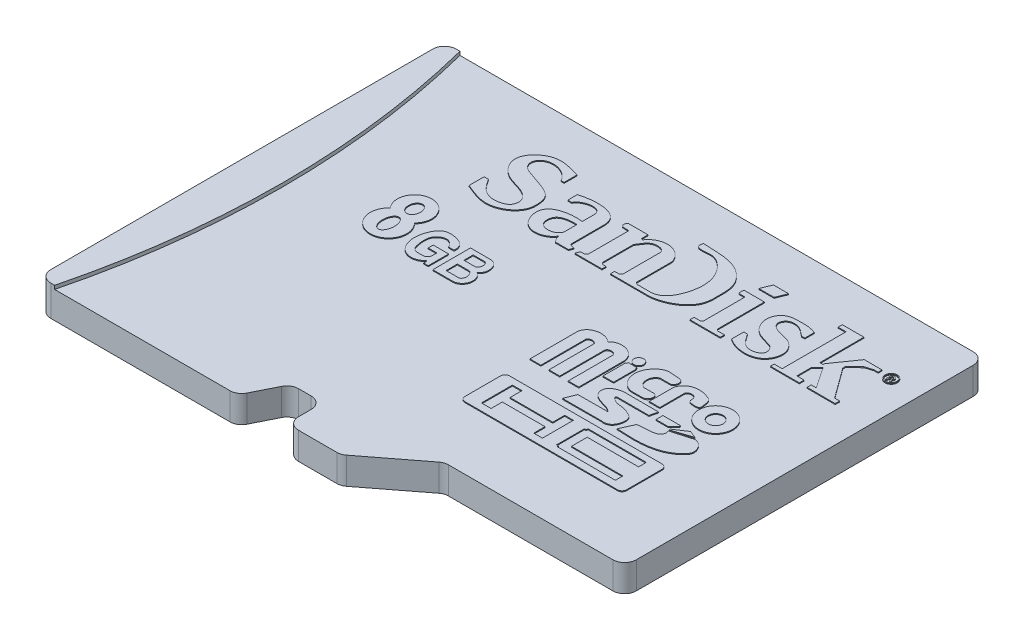
from build123d import *

# Parameters (mm, degrees)
SKETCH1_W           = 15.24
SKETCH1_H           = 11.43
BOSS_EXTRUDE1_DEPTH = 0.762
CUT_EXTRUDE1_DEPTH  = 0.762
CUT_EXTRUDE2_DEPTH  = 0.762
BOSS_EXTRUDE2_DEPTH = 0.1016
FILLET1_R           = 0.3302
SKETCH5_W           = 2.921
SKETCH5_H           = 0.889
BOSS_EXTRUDE3_DEPTH = 0.0254
SKETCH7_R           = 0.139269195
SKETCH7_R_2         = 0.478942614
SKETCH7_R_3         = 0.209449949
SKETCH7_RX          = 0.290632078
SKETCH7_RY          = 0.166319038
SKETCH7_RX_2        = 0.224370503
SKETCH7_RY_2        = 0.169046269
BOSS_EXTRUDE4_DEPTH = 0.0254
SKETCH8_R           = 0.171835043
SKETCH8_R_2         = 0.150224885
BOSS_EXTRUDE6_DEPTH = 0.0254


with BuildPart() as part:
    # Sketch1 → Boss-Extrude1 (new body)
    with BuildSketch(Plane(origin=(0, 0, 0), x_dir=(1, 0, 0), z_dir=(0, 1, 0))):
        with Locations((-7.62, 5.715)):
            Rectangle(SKETCH1_W, SKETCH1_H)
    extrude(amount=BOSS_EXTRUDE1_DEPTH)

    # Sketch2 → Cut-Extrude1 (cut)
    with BuildSketch(Plane(origin=(0, 0.762, 0), x_dir=(-1, 0, 0), z_dir=(0, 1, 0))):
        Polygon((6.731, 0), (0, 0), (0, -1.27), (5.08, -1.27), align=None)
    extrude(amount=-CUT_EXTRUDE1_DEPTH, mode=Mode.SUBTRACT)

    # Sketch3 → Cut-Extrude2 (cut)
    with BuildSketch(Plane(origin=(0, 0.762, 0), x_dir=(-1, 0, 0), z_dir=(0, 1, 0))):
        Polygon((9.652, 0), (8.255, 0), (8.255, -1.016), (9.144, -1.016), align=None)
    extrude(amount=-CUT_EXTRUDE2_DEPTH, mode=Mode.SUBTRACT)

    # Sketch4 → Boss-Extrude2 (add)
    with BuildSketch(Plane(origin=(0, 0.762, 0), x_dir=(1, 0, 0), z_dir=(0, 1, 0))):
        with BuildLine():
            Line((-15.24, 0), (-14.802465502, 0))
            ThreePointArc((-14.802465502, 0), (-14.089586207, 5.715), (-14.802465502, 11.43))
            Line((-14.802465502, 11.43), (-15.24, 11.43))
            Line((-15.24, 11.43), (-15.24, 0))
        make_face()
    extrude(amount=BOSS_EXTRUDE2_DEPTH)

    # Fillet1
    fillet1_edges = [part.edges().sort_by_distance(p)[0] for p in [
        (-15.24, 0.4318, -11.43),
        (0, 0.381, -11.43),
        (0, 0.381, -1.27),
        (-15.24, 0.4318, 0),
        (-9.652, 0.381, 0),
        (-6.731, 0.381, 0),
        (-8.255, 0.381, -1.016),
        (-8.255, 0.381, 0),
        (-9.144, 0.381, -1.016),
        (-5.08, 0.381, -1.27),
    ]]
    fillet(fillet1_edges, radius=FILLET1_R)

    # Sketch5 → Boss-Extrude3 (add)
    with BuildSketch(Plane.XZ):
        with Locations((-2.4765, -10.2235)):
            Rectangle(SKETCH5_W, SKETCH5_H)
        with Locations((-2.4765, -9.0805)):
            Rectangle(SKETCH5_W, SKETCH5_H)
        Polygon((-1.016, -8.382), (-0.508, -8.382), (-0.508, -7.493), (-1.016, -7.493), (-3.937, -7.493), (-3.937, -8.382), align=None)
        with Locations((-2.4765, -6.7945)):
            Rectangle(SKETCH5_W, SKETCH5_H)
        Polygon((-1.016, -6.096), (-0.508, -6.096), (-0.508, -5.207), (-1.016, -5.207), (-3.937, -5.207), (-3.937, -6.096), align=None)
        with Locations((-2.4765, -4.5085)):
            Rectangle(SKETCH5_W, SKETCH5_H)
        with Locations((-2.4765, -3.3655)):
            Rectangle(SKETCH5_W, SKETCH5_H)
        with Locations((-2.4765, -2.2225)):
            Rectangle(SKETCH5_W, SKETCH5_H)
    extrude(amount=BOSS_EXTRUDE3_DEPTH)

    # Sketch7 → Boss-Extrude4 (add)
    # profile 1 of 14: a face of its own
    with BuildSketch(Plane(origin=(0, 0.762, 0), x_dir=(1, 0, 0), z_dir=(0, 1, 0))):
        with Locations(Location((-4.776841085, 6.447605334, 0), (0, 0, 270))):
            Circle(SKETCH7_R)
    # profile 2 of 14: a face of its own
    with BuildSketch(Plane(origin=(0, 0.762, 0), x_dir=(1, 0, 0), z_dir=(0, 1, 0))):
        with Locations(Location((-2.277569556, 6.117436362, 0), (0, 0, 270))):
            Circle(SKETCH7_R_2)
        with Locations(Location((-2.277569556, 6.117436362, 0), (0, 0, 270))):
            Circle(SKETCH7_R_3, mode=Mode.SUBTRACT)
    # profile 3 of 14: a face of its own
    with BuildSketch(Plane(origin=(0, 0.762, 0), x_dir=(1, 0, 0), z_dir=(0, 1, 0))):
        with BuildLine():
            Line((-6.251320355, 4.277570766), (-1.948861584, 4.277570766))
            ThreePointArc((-1.948861584, 4.277570766), (-1.859059023, 4.240373327), (-1.821861584, 4.150570766))
            Line((-1.821861584, 4.150570766), (-1.821861584, 3.1466527))
            ThreePointArc((-1.821861584, 3.1466527), (-1.859059023, 3.056850139), (-1.948861584, 3.0196527))
            Line((-1.948861584, 3.0196527), (-6.251320355, 3.0196527))
            ThreePointArc((-6.251320355, 3.0196527), (-6.341122916, 3.056850139), (-6.378320355, 3.1466527))
            Line((-6.378320355, 3.1466527), (-6.378320355, 4.150570766))
            ThreePointArc((-6.378320355, 4.150570766), (-6.341122916, 4.240373327), (-6.251320355, 4.277570766))
        make_face()
        Polygon((-3.857521864, 3.260236837), (-3.857521864, 3.220393654), (-3.659080532, 3.220393654), (-2.210458816, 3.220393654), (-2.210458816, 3.432064407), (-3.659080532, 3.432064407), (-3.659080532, 3.875250046), (-2.210458816, 3.875250046), (-2.210458816, 4.09353551), (-3.659080532, 4.09353551), (-3.857521864, 4.09353551), (-3.857521864, 4.043149826), (-3.905082645, 4.043149826), (-3.905082645, 3.260236837), align=None, mode=Mode.SUBTRACT)
        Polygon((-5.987458817, 4.09353551), (-5.716255664, 4.09353551), (-5.716255664, 3.756185247), (-4.512378256, 3.756185247), (-4.512378256, 4.09353551), (-4.267633948, 4.09353551), (-4.267633948, 3.220393654), (-4.512378256, 3.220393654), (-4.512378256, 3.537899783), (-5.716255664, 3.537899783), (-5.716255664, 3.220393654), (-5.987458817, 3.220393654), align=None, mode=Mode.SUBTRACT)
    # profile 4 of 14: a face of its own
    with BuildSketch(Plane(origin=(0, 0.762, 0), x_dir=(1, 0, 0), z_dir=(0, 1, 0))):
        Polygon((-4.652156341, 6.238028849), (-4.630933406, 6.238028849), (-4.630933406, 5.590729327), (-4.933360232, 5.590729327), (-4.933360232, 6.238028849), (-4.901525829, 6.238028849), (-4.901525829, 6.275168986), (-4.652156341, 6.275168986), align=None)
    # profile 5 of 14: a face of its own
    with BuildSketch(Plane(origin=(0, 0.762, 0), x_dir=(1, 0, 0), z_dir=(0, 1, 0))):
        with BuildLine():
            Line((-6.378320355, 4.981284631), (-6.072293115, 4.981284631))
            Line((-6.072293115, 4.981284631), (-6.072293115, 6.254807833))
            add(Edge.make_bspline(
                [(-6.072293115, 6.254807833), (-6.025814039, 6.335469319), (-5.890908071, 6.339316485), (-5.844460983, 6.254807833)],
                knots=[0, 0, 0, 0, 1, 1, 1, 1], degree=3))
            Line((-5.844460983, 6.254807833), (-5.844460983, 4.981284631))
            Line((-5.844460983, 4.981284631), (-5.540684806, 4.981284631))
            Line((-5.540684806, 4.981284631), (-5.540684806, 6.254807833))
            add(Edge.make_bspline(
                [(-5.540684806, 6.254807833), (-5.501665325, 6.353707259), (-5.347044323, 6.339414302), (-5.301168975, 6.254807833)],
                knots=[0, 0, 0, 0, 1, 1, 1, 1], degree=3))
            Line((-5.301168975, 6.254807833), (-5.301168975, 4.981284631))
            Line((-5.301168975, 4.981284631), (-5.003234648, 4.981284631))
            Line((-5.003234648, 4.981284631), (-5.003234648, 6.254807833))
            add(Edge.make_bspline(
                [(-5.69376268, 6.491026115), (-5.578292108, 6.638112734), (-5.204569055, 6.651290462), (-5.00492282, 6.384604157), (-5.003234648, 6.254807833)],
                knots=[0, 0, 0, 0, 0.585628832, 1, 1, 1, 1], degree=3))
            add(Edge.make_bspline(
                [(-6.378320355, 6.254807833), (-6.394937508, 6.403298433), (-6.181945555, 6.662224119), (-5.816479439, 6.606701774), (-5.69376268, 6.491026115)],
                knots=[0, 0, 0, 0, 0.433334138, 1, 1, 1, 1], degree=3))
            Line((-6.378320355, 6.254807833), (-6.378320355, 4.981284631))
        make_face()
    # profile 6 of 14: a face of its own
    with BuildSketch(Plane(origin=(0, 0.762, 0), x_dir=(1, 0, 0), z_dir=(0, 1, 0))):
        with BuildLine():
            Line((-3.442930879, 4.5030381), (-3.276257799, 4.872496762))
            add(Edge.make_bspline(
                [(-3.276257799, 4.872496762), (-3.195110481, 4.932662785), (-2.709120649, 4.837904708), (-2.638964712, 5.080705659), (-2.665467627, 5.172797207)],
                knots=[0, 0, 0, 0, 0.752775711, 1, 1, 1, 1], degree=3))
            Line((-2.665467627, 5.172797207), (-2.092009037, 5.33783216))
            add(Edge.make_bspline(
                [(-2.092009037, 5.33783216), (-1.926617069, 5.348435845), (-1.698874786, 5.058554264), (-1.951912451, 4.763455103), (-2.460153942, 4.441377924), (-3.06272273, 4.484211554), (-3.442930879, 4.5030381)],
                knots=[0, 0, 0, 0, 0.217544023, 0.299739186, 0.470310745, 1, 1, 1, 1], degree=3))
        make_face()
    # profile 7 of 14: a face of its own
    with BuildSketch(Plane(origin=(0, 0.762, 0), x_dir=(1, 0, 0), z_dir=(0, 1, 0))):
        with BuildLine():
            Line((-3.659080532, 5.623363858), (-3.360429438, 5.623363858))
            Line((-3.360429438, 5.623363858), (-3.360429438, 6.311722044))
            add(Edge.make_bspline(
                [(-3.360429438, 6.311722044), (-3.347636385, 6.421440855), (-3.070126057, 6.43156953), (-3.125995463, 6.179769947), (-2.952128865, 6.154782514), (-2.775652786, 6.156698262), (-2.805150185, 6.378208564), (-2.819654485, 6.524921156), (-2.960942589, 6.554276085)],
                knots=[0, 0, 0, 0, 0.243554691, 0.369108319, 0.483304483, 0.637610814, 0.698918809, 1, 1, 1, 1], degree=3))
            add(Edge.make_bspline(
                [(-2.960942589, 6.554276085), (-3.20547441, 6.664771248), (-3.574720557, 6.627305367), (-3.659080532, 6.311722044)],
                knots=[0, 0, 0, 0, 1, 1, 1, 1], degree=3))
            Line((-3.659080532, 6.311722044), (-3.659080532, 5.623363858))
        make_face()
    # profile 8 of 14: a face of its own
    with BuildSketch(Plane(origin=(0, 0.762, 0), x_dir=(1, 0, 0), z_dir=(0, 1, 0))):
        with BuildLine():
            Line((-3.789933508, 5.886994865), (-4.07321967, 5.886994865))
            add(Edge.make_bspline(
                [(-4.07321967, 5.886994865), (-4.277518839, 5.964071662), (-4.265313745, 6.27578154), (-4.07321967, 6.346669088)],
                knots=[0, 0, 0, 0, 1, 1, 1, 1], degree=3))
            Line((-4.07321967, 6.346669088), (-3.789933508, 6.346669088))
            add(Edge.make_bspline(
                [(-3.789933508, 6.346669088), (-3.696468044, 6.349630045), (-3.639221758, 6.544683875), (-3.79170836, 6.609723132), (-3.943439574, 6.612172312), (-4.16602438, 6.650466802), (-4.422967428, 6.47748107), (-4.58812953, 6.17446695), (-4.499132014, 5.801670094), (-4.257188662, 5.612408196), (-4.057365325, 5.625306909), (-3.927449206, 5.624221807), (-3.786914384, 5.617884149), (-3.679471553, 5.738603932), (-3.694660661, 5.881329067), (-3.789933508, 5.886994865)],
                knots=[0, 0, 0, 0, 0.096112811, 0.118936397, 0.169797033, 0.264008921, 0.353301334, 0.48850177, 0.615129524, 0.743913282, 0.779012427, 0.830597536, 0.890279647, 0.9173965, 1, 1, 1, 1], degree=3))
        make_face()
    # profile 9 of 14: a face of its own
    with BuildSketch(Plane(origin=(0, 0.762, 0), x_dir=(1, 0, 0), z_dir=(0, 1, 0))):
        Polygon((-2.665467627, 5.212217504), (-2.176105088, 5.377160968), (-2.135135362, 5.390970134), (-2.338225648, 5.472666044), (-2.687459426, 5.243161695), (-2.677029445, 5.212217504), align=None)
    # profile 10 of 14: a face of its own
    with BuildSketch(Plane(origin=(0, 0.762, 0), x_dir=(1, 0, 0), z_dir=(0, 1, 0))):
        Polygon((-2.791284889, 5.277605324), (-2.622841988, 5.446048225), (-2.622841988, 5.472666044), (-2.791284889, 5.472666044), (-3.120813015, 5.472666044), (-3.120813015, 5.277605324), align=None)
    # profile 11 of 14: a face of its own
    with BuildSketch(Plane(origin=(0, 0.762, 0), x_dir=(1, 0, 0), z_dir=(0, 1, 0))):
        with BuildLine():
            Line((-3.270421848, 5.497775611), (-3.321593699, 5.277605324))
            Line((-3.321593699, 5.277605324), (-4.169595375, 5.277605324))
            add(Edge.make_bspline(
                [(-3.857521864, 4.477651008), (-3.6649182, 4.440969553), (-3.506100098, 4.637478531), (-3.520645806, 4.946873191), (-3.687036003, 5.040375411), (-3.890745545, 5.123789916), (-4.118976167, 5.09476977), (-4.301278004, 5.28340594), (-4.169595375, 5.277605324)],
                knots=[0, 0, 0, 0, 0.302788359, 0.449483843, 0.525021964, 0.661723021, 0.875336196, 1, 1, 1, 1], degree=3))
            Line((-3.857521864, 4.477651008), (-4.957941799, 4.473800726))
            Line((-4.957941799, 4.473800726), (-4.832807637, 4.78374842))
            Line((-4.832807637, 4.78374842), (-3.98083226, 4.789126105))
            add(Edge.make_bspline(
                [(-3.98083226, 4.789126105), (-4.007204032, 4.8036281), (-4.05204006, 4.841430131), (-4.157303597, 4.887168793), (-4.091605758, 4.876762633), (-4.216322989, 4.906102312)],
                knots=[0, 0, 0, 0, 0.136929996, 0.181845441, 0.449154446, 0.449154446, 0.449154446, 0.449154446], degree=3))
            add(Edge.make_bspline(
                [(-4.216322989, 4.906102312), (-4.333705814, 4.943445547), (-4.569057228, 4.995484764), (-4.655310287, 5.412905613), (-4.292322037, 5.515936374), (-4.163754423, 5.497775611)],
                knots=[0, 0, 0, 0, 0.366224678, 0.534720428, 1, 1, 1, 1], degree=3))
            Line((-4.163754423, 5.497775611), (-3.270421848, 5.497775611))
        make_face()
    # profile 12 of 14: a face of its own
    with BuildSketch(Plane(origin=(0, 0.762, 0), x_dir=(1, 0, 0), z_dir=(0, 1, 0))):
        with BuildLine():
            Line((-10.088130604, 5.822744395), (-10.088130604, 6.396763029))
            Line((-10.088130604, 6.396763029), (-10.524340326, 6.396763029))
            Line((-10.524340326, 6.396763029), (-10.524340326, 6.254807833))
            Line((-10.524340326, 6.254807833), (-10.278707667, 6.254807833))
            Line((-10.278707667, 6.254807833), (-10.278707667, 6.109753712))
            add(Edge.make_bspline(
                [(-10.278707667, 6.109753712), (-10.322245515, 5.981572435), (-10.419554072, 5.996573997), (-10.692784625, 5.989470413), (-10.765902538, 6.195881523), (-10.795784991, 6.588376289), (-10.552834542, 6.746726551), (-10.420627587, 6.735046541), (-10.374746649, 6.700970716)],
                knots=[0, 0, 0, 0, 0.171188729, 0.229954091, 0.387962423, 0.569830254, 0.723250193, 0.820267485, 0.820267485, 0.820267485, 0.820267485], degree=3))
            add(Edge.make_bspline(
                [(-10.374746649, 6.700970716), (-10.361083627, 6.690002358), (-10.331254784, 6.666056453), (-10.302937556, 6.640337732), (-10.28759096, 6.626399403)],
                knots=[0, 0, 0, 0, 0.458047365, 1, 1, 1, 1], degree=3))
            Line((-10.28759096, 6.626399403), (-10.258391962, 6.565093889))
            Line((-10.258391962, 6.565093889), (-10.234645397, 6.565093889))
            Line((-10.234645397, 6.565093889), (-10.106895272, 6.565093889))
            add(Edge.make_bspline(
                [(-10.106895272, 6.565093889), (-10.079625278, 6.748260422), (-10.248765594, 6.851392864)],
                knots=[0, 0, 0, 1, 1, 1], degree=2))
            add(Edge.make_bspline(
                [(-10.248765594, 6.851392864), (-10.384002118, 6.90999523), (-10.696369379, 6.978056856), (-10.890397638, 6.697974731), (-10.972414444, 6.454925721), (-10.987079209, 6.140377835), (-10.811602448, 5.830055685), (-10.488808744, 5.756631141), (-10.311153417, 5.845021196), (-10.248765594, 5.917793038)],
                knots=[0, 0, 0, 0, 0.227517437, 0.330561503, 0.433579756, 0.580561359, 0.751682886, 0.86858874, 1, 1, 1, 1], degree=3))
            Line((-10.248765594, 5.917793038), (-10.219492752, 5.917793038))
            Line((-10.219492752, 5.917793038), (-10.219492752, 5.822744395))
            Line((-10.219492752, 5.822744395), (-10.088130604, 5.822744395))
        make_face()
    # profile 13 of 14: a face of its own
    with BuildSketch(Plane(origin=(0, 0.762, 0), x_dir=(1, 0, 0), z_dir=(0, 1, 0))):
        with BuildLine():
            Line((-9.927198862, 6.851392864), (-9.927198862, 5.788396357))
            Line((-9.927198862, 5.788396357), (-9.402053177, 5.788396357))
            add(Edge.make_bspline(
                [(-9.402053177, 5.788396357), (-9.243957965, 5.777475822), (-9.017117684, 5.98687876), (-9.11583175, 6.288157941), (-9.24115103, 6.346669088)],
                knots=[0, 0, 0, 0, 0.510294589, 1, 1, 1, 1], degree=3))
            add(Edge.make_bspline(
                [(-9.24115103, 6.346669088), (-9.028875277, 6.462165203), (-9.114421292, 6.886678523), (-9.402053177, 6.851392864)],
                knots=[0, 0, 0, 0, 1, 1, 1, 1], degree=3))
            Line((-9.402053177, 6.851392864), (-9.927198862, 6.851392864))
        make_face()
        with BuildLine():
            Line((-9.719326569, 5.955756046), (-9.719326569, 6.275168986))
            Line((-9.719326569, 6.275168986), (-9.375411117, 6.275168986))
            add(Edge.make_bspline(
                [(-9.375411117, 5.955756046), (-9.319960535, 5.956015799), (-9.230142665, 6.09052178), (-9.309120454, 6.229274643), (-9.375411117, 6.275168986)],
                knots=[0, 0, 0, 0, 0.381650519, 1, 1, 1, 1], degree=3))
            Line((-9.375411117, 5.955756046), (-9.719326569, 5.955756046))
        make_face(mode=Mode.SUBTRACT)
        with BuildLine():
            Line((-9.719326569, 6.719349207), (-9.719326569, 6.458374795))
            Line((-9.719326569, 6.458374795), (-9.402053177, 6.458374795))
            add(Edge.make_bspline(
                [(-9.402053177, 6.719349207), (-9.340420425, 6.707464429), (-9.290996198, 6.591273172), (-9.340962314, 6.481268943), (-9.402053177, 6.458374795)],
                knots=[0, 0, 0, 0, 0.48427238, 1, 1, 1, 1], degree=3))
            Line((-9.402053177, 6.719349207), (-9.719326569, 6.719349207))
        make_face(mode=Mode.SUBTRACT)
    # profile 14 of 14: a face of its own
    with BuildSketch(Plane(origin=(0, 0.762, 0), x_dir=(1, 0, 0), z_dir=(0, 1, 0))):
        with BuildLine():
            ThreePointArc((-12.032854223, 6.695770031), (-11.707080782, 5.787645253), (-11.327161193, 6.67448236))
            ThreePointArc((-11.327161193, 6.67448236), (-11.655283903, 7.504728181), (-12.032854223, 6.695770031))
        make_face()
        with Locations(Location((-11.691451922, 6.305746898), (0, 0, 90))):
            Ellipse(SKETCH7_RX, SKETCH7_RY, mode=Mode.SUBTRACT)
        with Locations(Location((-11.669936942, 7.018975284), (0, 0, -90))):
            Ellipse(SKETCH7_RX_2, SKETCH7_RY_2, mode=Mode.SUBTRACT)
    extrude(amount=BOSS_EXTRUDE4_DEPTH)

    # Sketch8 → Boss-Extrude6 (add)
    # profile 1 of 9: a face of its own
    with BuildSketch(Plane(origin=(0, 0.762, 0), x_dir=(1, 0, 0), z_dir=(0, 1, 0))):
        with Locations(Location((-0.810279055, 9.597990692, 0), (0, 0, 270))):
            Circle(SKETCH8_R)
        with Locations(Location((-0.810279055, 9.597990692, 0), (0, 0, 270))):
            Circle(SKETCH8_R_2, mode=Mode.SUBTRACT)
    # profile 2 of 9: a face of its own
    with BuildSketch(Plane(origin=(0, 0.762, 0), x_dir=(1, 0, 0), z_dir=(0, 1, 0))):
        with BuildLine():
            add(Edge.make_bspline(
                [(-0.875713963, 9.675302288), (-0.819925575, 9.739366), (-0.677472879, 9.647905333), (-0.76198186, 9.579954384)],
                knots=[0, 0, 0, 0, 1, 1, 1, 1], degree=3))
            Line((-0.76198186, 9.579954384), (-0.729562786, 9.499759306))
            Line((-0.729562786, 9.499759306), (-0.765677546, 9.499759306))
            Line((-0.765677546, 9.499759306), (-0.788394894, 9.565872616))
            Line((-0.788394894, 9.565872616), (-0.841110793, 9.565872616))
            Line((-0.841110793, 9.565872616), (-0.841110793, 9.499759306))
            Line((-0.841110793, 9.499759306), (-0.875713963, 9.499759306))
            Line((-0.875713963, 9.499759306), (-0.875713963, 9.504010766))
            Line((-0.875713963, 9.504010766), (-0.875713963, 9.675302288))
        make_face()
        with BuildLine():
            ThreePointArc((-0.810279055, 9.589855645), (-0.774638526, 9.625496173), (-0.810279055, 9.661136702))
            Line((-0.810279055, 9.661136702), (-0.845919584, 9.661136702))
            Line((-0.845919584, 9.661136702), (-0.845919584, 9.589855645))
            Line((-0.845919584, 9.589855645), (-0.810279055, 9.589855645))
        make_face(mode=Mode.SUBTRACT)
    # profile 3 of 9: a face of its own
    with BuildSketch(Plane(origin=(0, 0.762, 0), x_dir=(1, 0, 0), z_dir=(0, 1, 0))):
        Polygon((-1.996850249, 8.19340523), (-1.996850249, 8.328887468), (-2.200432631, 8.328887468), (-2.200432631, 8.733358684), (-2.034742605, 8.89904871), (-1.647498691, 8.328887468), (-1.647498691, 8.309872563), (-1.77694651, 8.309872563), (-1.77694651, 8.19340523), (-0.984553165, 8.19340523), (-0.984553165, 8.319380015), (-1.12621878, 8.319380015), (-1.743493967, 9.166395086), (-1.743493967, 9.236597281), (-1.476994583, 9.499759306), (-1.262845576, 9.565872616), (-1.145810653, 9.565872616), (-1.145810653, 9.675302288), (-1.647498691, 9.675302288), (-2.109133454, 9.015757192), (-2.109133454, 8.976516622), (-2.200432631, 8.976516622), (-2.200432631, 10.218711078), (-2.809875829, 10.218711078), (-2.809875829, 10.099484416), (-2.584156126, 10.099484416), (-2.584156126, 8.296788125), (-2.809875829, 8.296788125), (-2.809875829, 8.19340523), align=None)
    # profile 4 of 9: a face of its own
    with BuildSketch(Plane(origin=(0, 0.762, 0), x_dir=(1, 0, 0), z_dir=(0, 1, 0))):
        with BuildLine():
            add(Edge.make_bspline(
                [(-3.103554732, 9.365833099), (-3.195877054, 9.434000275), (-3.347263788, 9.595333763), (-3.699451678, 9.580870387), (-3.798523567, 9.298769795), (-3.533762916, 9.114886478), (-3.195741467, 9.12032386), (-2.844351063, 8.764064303), (-3.097014561, 8.027078574), (-3.788240821, 8.138784256), (-4.022029472, 8.309872563)],
                knots=[0, 0, 0, 0, 0.10236425, 0.197563773, 0.250005214, 0.324552804, 0.434792165, 0.557846919, 0.704556384, 1, 1, 1, 1], degree=3))
            Line((-4.022029472, 8.309872563), (-4.022029472, 8.653697322))
            Line((-4.022029472, 8.653697322), (-3.918022469, 8.653697322))
            add(Edge.make_bspline(
                [(-3.918022469, 8.653697322), (-3.844827753, 8.554222214), (-3.722160942, 8.314608957), (-3.394507905, 8.286728928), (-3.158939206, 8.441434633), (-3.258055507, 8.676910708), (-3.432236441, 8.712922235), (-3.551764289, 8.761423004), (-3.902154463, 8.85519056), (-4.102687009, 9.208166252), (-3.971324575, 9.479382059)],
                knots=[0, 0, 0, 0, 0.171535744, 0.302151344, 0.380829133, 0.486857541, 0.532299497, 0.607553917, 0.653711172, 1, 1, 1, 1], degree=3))
            add(Edge.make_bspline(
                [(-3.971324575, 9.479382059), (-3.876820068, 9.680432639), (-3.508613579, 9.707106478), (-3.168705815, 9.697992423), (-3.013194044, 9.63176446)],
                knots=[0, 0, 0, 0, 0.528193232, 1, 1, 1, 1], degree=3))
            Line((-3.013194044, 9.63176446), (-3.013194044, 9.365833099))
            Line((-3.013194044, 9.365833099), (-3.103554732, 9.365833099))
        make_face()
    # profile 5 of 9: a face of its own
    with BuildSketch(Plane(origin=(0, 0.762, 0), x_dir=(1, 0, 0), z_dir=(0, 1, 0))):
        Polygon((-5.030552657, 9.52496903), (-4.8605345, 9.522220261), (-4.857724174, 9.504010766), (-4.857724174, 8.356276357), (-4.904127968, 8.309872563), (-5.080992894, 8.309872563), (-5.080992894, 8.19340523), (-4.222773891, 8.19340523), (-4.222773891, 8.309872563), (-4.420839252, 8.309872563), (-4.46322301, 8.352256321), (-4.46322301, 9.675302288), (-5.037040479, 9.675302288), (-5.044693109, 9.63176446), (-5.044693109, 9.604754691), (-5.044693109, 9.589855645), (-5.044693109, 9.565872616), (-5.040866794, 9.554804371), align=None)
    # profile 6 of 9: a face of its own
    with BuildSketch(Plane(origin=(0, 0.762, 0), x_dir=(1, 0, 0), z_dir=(0, 1, 0))):
        with BuildLine():
            add(Edge.make_bspline(
                [(-6.749088189, 10.244292243), (-6.406422027, 10.219391433), (-5.798936147, 10.268613517), (-5.268476567, 9.706795419), (-5.261519567, 9.217823225), (-5.248357388, 8.51349394), (-5.936232919, 8.192663439), (-6.273914984, 8.19340523)],
                knots=[0, 0, 0, 0, 0.290578758, 0.450128151, 0.558005535, 0.682220279, 1, 1, 1, 1], degree=3))
            Line((-6.273914984, 8.19340523), (-7.323079282, 8.19340523))
            Line((-7.323079282, 8.19340523), (-7.323079282, 8.309872563))
            Line((-7.323079282, 8.309872563), (-7.196352161, 8.309872563))
            Line((-7.196352161, 8.309872563), (-7.186745463, 8.309872563))
            Line((-7.186745463, 8.309872563), (-7.14034167, 8.356276357))
            Line((-7.14034167, 8.356276357), (-7.14034167, 9.365833099))
            add(Edge.make_bspline(
                [(-7.712210165, 9.236597281), (-7.649978047, 9.323208083), (-7.563418919, 9.521620648), (-7.27527465, 9.564927779), (-7.126966588, 9.4815588), (-7.14034167, 9.365833099)],
                knots=[0, 0, 0, 0, 0.432808199, 0.678709916, 1, 1, 1, 1], degree=3))
            Line((-7.712210165, 9.236597281), (-7.712210165, 8.356276357))
            Line((-7.712210165, 8.356276357), (-7.665806372, 8.309872563))
            Line((-7.665806372, 8.309872563), (-7.561367931, 8.309872563))
            Line((-7.561367931, 8.309872563), (-7.561367931, 8.19340523))
            Line((-7.561367931, 8.19340523), (-8.325308151, 8.19340523))
            Line((-8.325308151, 8.19340523), (-8.284355941, 8.309872563))
            Line((-8.284355941, 8.309872563), (-8.161499311, 8.309872563))
            Line((-8.161499311, 8.309872563), (-8.116072097, 8.356276357))
            Line((-8.116072097, 8.356276357), (-8.116072097, 9.50752838))
            Line((-8.116072097, 9.50752838), (-8.228848369, 9.50752838))
            add(Edge.make_bspline(
                [(-8.284355941, 9.675302288), (-8.326681835, 9.671752583), (-8.338021251, 9.613383574), (-8.34171667, 9.550286368), (-8.303027031, 9.504806536), (-8.253125825, 9.514401941), (-8.228848369, 9.50752838)],
                knots=[0, 0, 0, 0, 0.374562728, 0.583509308, 0.663142623, 1, 1, 1, 1], degree=3))
            Line((-8.284355941, 9.675302288), (-7.743499862, 9.675302288))
            Line((-7.743499862, 9.675302288), (-7.743499862, 9.63176446))
            Line((-7.743499862, 9.63176446), (-7.743499862, 9.479382059))
            Line((-7.743499862, 9.479382059), (-7.693742343, 9.479382059))
            add(Edge.make_bspline(
                [(-6.749088189, 9.365833099), (-6.797150012, 9.518883835), (-7.112991514, 9.834517195), (-7.570569788, 9.671761324), (-7.693742343, 9.479382059)],
                knots=[0, 0, 0, 0, 0.415672077, 1, 1, 1, 1], degree=3))
            Line((-6.749088189, 9.365833099), (-6.749088189, 8.356276357))
            Line((-6.749088189, 8.356276357), (-6.702684395, 8.309872563))
            Line((-6.702684395, 8.309872563), (-6.346534995, 8.309872563))
            add(Edge.make_bspline(
                [(-6.346534995, 8.309872563), (-6.028064353, 8.295023549), (-5.741397037, 8.787612726), (-5.687539812, 9.510902085), (-6.019967585, 9.963730513), (-6.43636833, 10.135459371), (-6.830226851, 9.968214117), (-6.749088189, 10.244292243)],
                knots=[0, 0, 0, 0, 0.290209292, 0.518144451, 0.741160218, 0.808080429, 1, 1, 1, 1], degree=3))
        make_face()
    # profile 7 of 9: a face of its own
    with BuildSketch(Plane(origin=(0, 0.762, 0), x_dir=(1, 0, 0), z_dir=(0, 1, 0))):
        with BuildLine():
            Line((-8.508698425, 8.19340523), (-8.464276456, 8.309872563))
            add(Edge.make_bspline(
                [(-8.464276456, 8.309872563), (-8.616415281, 8.329509503), (-8.606165785, 8.38645324)],
                knots=[0, 0, 0, 0.687710623, 0.687710623, 0.687710623], degree=2))
            Line((-8.606165785, 8.38645324), (-8.606165785, 9.321256656))
            add(Edge.make_bspline(
                [(-8.606165785, 9.321256656), (-8.63015311, 9.862733075), (-9.426016927, 9.752532163), (-9.723443941, 9.658960235)],
                knots=[0, 0, 0, 0, 1, 1, 1, 1], degree=3))
            Line((-9.723443941, 9.658960235), (-9.723443941, 9.392751619))
            Line((-9.723443941, 9.392751619), (-9.610036008, 9.392751619))
            add(Edge.make_bspline(
                [(-8.997726574, 9.380693983), (-8.97376602, 9.724425676), (-9.527311894, 9.599996912), (-9.610036008, 9.392751619)],
                knots=[0, 0, 0, 0, 1, 1, 1, 1], degree=3))
            Line((-8.997726574, 9.380693983), (-8.997726574, 9.070340471))
            add(Edge.make_bspline(
                [(-8.975791641, 8.38645324), (-9.099064174, 8.167203277), (-9.731793056, 7.992582693), (-10.062441992, 9.059609544), (-9.198854772, 9.109107347), (-8.997726574, 9.070340471)],
                knots=[0, 0, 0, 0, 0.332328837, 0.599425737, 1, 1, 1, 1], degree=3))
            add(Edge.make_bspline(
                [(-8.870784295, 8.19340523), (-8.961069831, 8.291732343), (-8.975791641, 8.38645324)],
                knots=[0, 0, 0, 0.331538768, 0.331538768, 0.331538768], degree=2))
            Line((-8.870784295, 8.19340523), (-8.508698425, 8.19340523))
        make_face()
        with BuildLine():
            add(Edge.make_bspline(
                [(-8.997726574, 8.927275521), (-9.139317029, 8.926542707), (-9.542240568, 8.932853368), (-9.558907974, 8.304421432), (-9.051486762, 8.366676817), (-8.997726574, 8.561721071)],
                knots=[0, 0, 0, 0, 0.378426678, 0.595167906, 1, 1, 1, 1], degree=3))
            Line((-8.997726574, 8.561721071), (-8.997726574, 8.927275521))
        make_face(mode=Mode.SUBTRACT)
    # profile 8 of 9: a face of its own
    with BuildSketch(Plane(origin=(0, 0.762, 0), x_dir=(1, 0, 0), z_dir=(0, 1, 0))):
        with BuildLine():
            add(Edge.make_bspline(
                [(-10.293639492, 9.773659513), (-10.367010281, 9.903215747), (-10.574613545, 10.064932546), (-10.904280832, 10.087855698), (-11.133179836, 9.969893559), (-11.194129448, 9.744228904), (-11.057330339, 9.574426154), (-10.847687752, 9.502456757), (-10.60554909, 9.415645481), (-10.335750149, 9.329249538), (-10.100376172, 9.177827606), (-10.042490767, 8.903983261), (-10.052318325, 8.455010326), (-10.744466874, 8.021429444), (-11.241548344, 8.266045685), (-11.473058938, 8.356276357)],
                knots=[0, 0, 0, 0, 0.099105479, 0.164709036, 0.211337109, 0.2614988, 0.296298147, 0.346607183, 0.40775157, 0.468695619, 0.539665342, 0.577747633, 0.650875112, 0.82965366, 1, 1, 1, 1], degree=3))
            Line((-11.473058938, 8.356276357), (-11.473058938, 8.780805859))
            Line((-11.473058938, 8.780805859), (-11.350371457, 8.780805859))
            add(Edge.make_bspline(
                [(-11.350371457, 8.780805859), (-11.263110378, 8.640807248), (-11.0621834, 8.350545408), (-10.65449073, 8.345777609), (-10.395520506, 8.465285702), (-10.336990913, 8.691524841), (-10.451258989, 8.862782685), (-10.718326664, 9.039274625), (-11.186125534, 9.074797329), (-11.663634669, 9.726376931), (-11.114986482, 10.253016938), (-10.613165937, 10.258531975), (-10.367225925, 10.179896775), (-10.228657342, 10.147894936)],
                knots=[0, 0, 0, 0, 0.119926717, 0.211938983, 0.253862626, 0.306778335, 0.345951057, 0.387534625, 0.522258552, 0.65698248, 0.82958503, 0.899642385, 1, 1, 1, 1], degree=3))
            Line((-10.228657342, 10.147894936), (-10.208297298, 10.143192868))
            Line((-10.208297298, 10.143192868), (-10.208297298, 9.773659513))
            Line((-10.208297298, 9.773659513), (-10.293639492, 9.773659513))
        make_face()
    # profile 9 of 9: a face of its own
    with BuildSketch(Plane(origin=(0, 0.762, 0), x_dir=(1, 0, 0), z_dir=(0, 1, 0))):
        Polygon((-4.868930891, 9.926372598), (-4.8605345, 9.950255334), (-4.750131745, 10.218711078), (-4.321806571, 10.218711078), (-4.442031131, 9.926372598), align=None)
    extrude(amount=BOSS_EXTRUDE6_DEPTH)


solid = part.part
